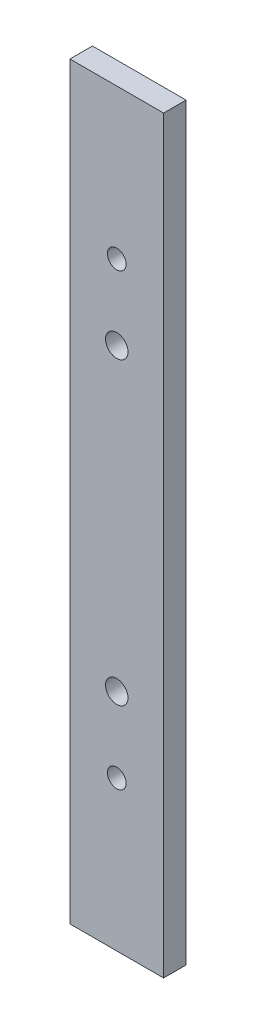
from build123d import *

# Parameters (mm, degrees)
SKETCH1_W           = 25
SKETCH1_H           = 200
BOSS_EXTRUDE1_DEPTH = 6
SKETCH2_R           = 2.5
SKETCH2_R_2         = 3
CUT_EXTRUDE1_DEPTH  = 6


with BuildPart() as part:
    # Sketch1 → Boss-Extrude1 (new body)
    with BuildSketch(Plane.XY):
        Rectangle(SKETCH1_W, SKETCH1_H)
    extrude(amount=BOSS_EXTRUDE1_DEPTH)

    # Sketch2 → Cut-Extrude1 (cut)
    with BuildSketch(Plane.XY.offset(6)):
        with Locations((0, -60)):
            Circle(SKETCH2_R)
        with Locations(Location((0, 60, 0), (0, 0, 180))):
            Circle(SKETCH2_R)
        with Locations((0, -40)):
            Circle(SKETCH2_R_2)
        with Locations(Location((0, 40, 0), (0, 0, 180))):
            Circle(SKETCH2_R_2)
    extrude(amount=-CUT_EXTRUDE1_DEPTH, mode=Mode.SUBTRACT)


solid = part.part
